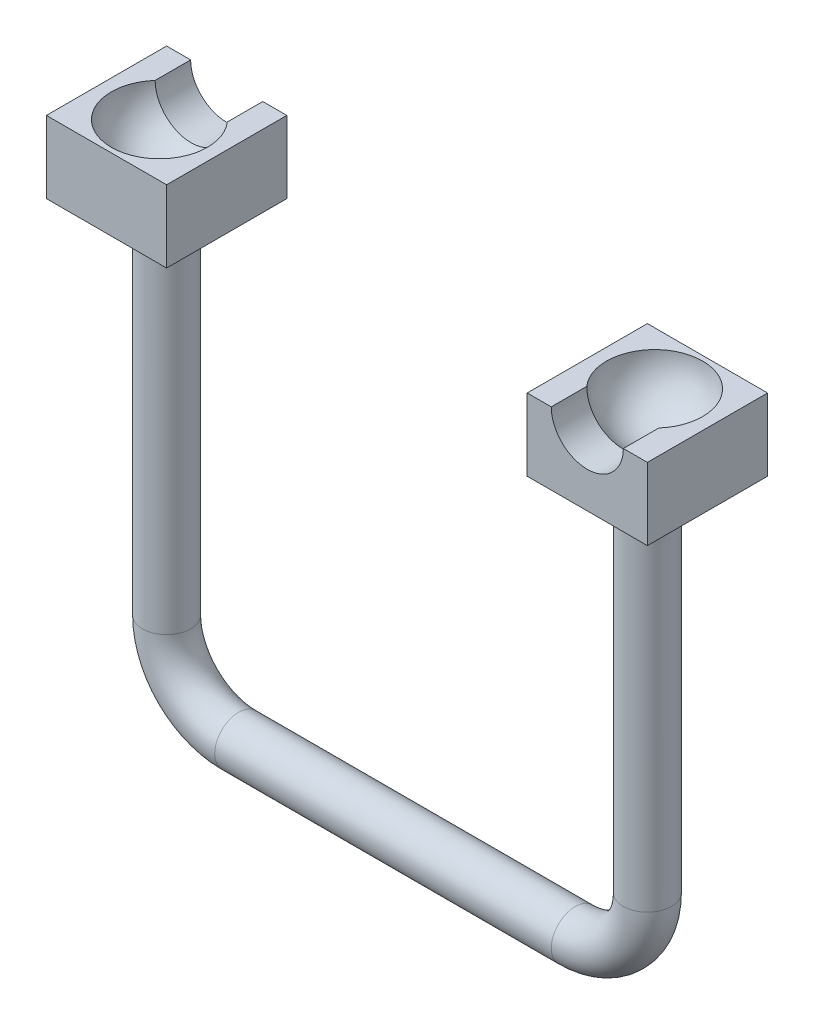
from build123d import *

# Parameters (mm, degrees)
SKETCH2_R           = 5
SKETCH4_W           = 25
SKETCH4_H           = 25
BOSS_EXTRUDE1_DEPTH = 15
SKETCH7_R           = 7.5
CUT_EXTRUDE2_DEPTH  = 15
SKETCH15_W          = 25
SKETCH15_H          = 25
BOSS_EXTRUDE3_DEPTH = 15
SKETCH17_R          = 7.5
CUT_EXTRUDE3_DEPTH  = 15


with BuildPart() as part:
    # Sweep1: sweep along a path in Sketch1
    with BuildLine(Plane.XY) as sweep1_path:
        Line((0, 0), (0, -75))
        ThreePointArc((0, -75), (4.393398122, -85.60660133), (14.999999452, -89.999999452))
        Line((14.999999452, -89.999999452), (85, -89.999999452))
        ThreePointArc((85, -89.999999452), (95.606601718, -85.60660117), (100, -74.999999452))
        Line((100, -74.999999452), (100, 0))
    # Sketch2 → Sweep1 (sweep)
    with BuildSketch(Plane(origin=(0, 0, 0), x_dir=(1, 0, 0), z_dir=(0, 1, 0))):
        Circle(SKETCH2_R)
    sweep(path=sweep1_path.line)

    # Sketch4 → Boss-Extrude1 (add)
    with BuildSketch(Plane(origin=(0, 0, 0), x_dir=(1, 0, 0), z_dir=(0, 1, 0))):
        Rectangle(SKETCH4_W, SKETCH4_H)
    extrude(amount=BOSS_EXTRUDE1_DEPTH)

    # Sketch5 → Cut-Revolve1 (revolve, cut)
    with BuildSketch(Plane(origin=(0, 15, 0), x_dir=(1, 0, 0), z_dir=(0, 1, 0))):
        with BuildLine():
            Line((0, 8.5), (0, -11.5))
            ThreePointArc((0, -11.5), (10, -1.5), (0, 8.5))
        make_face()
    revolve(axis=Axis((0, 15, -8.5), (0, 0, 1)), mode=Mode.SUBTRACT)

    # Sketch7 → Cut-Extrude2 (cut)
    with BuildSketch(Plane(origin=(0, 0, -12.5), x_dir=(-1, 0, 0), z_dir=(0, 0, -1))):
        with Locations((0, 15)):
            Circle(SKETCH7_R)
    extrude(amount=-CUT_EXTRUDE2_DEPTH, mode=Mode.SUBTRACT)

    # Sketch15 → Boss-Extrude3 (add)
    with BuildSketch(Plane(origin=(0, 0, 0), x_dir=(1, 0, 0), z_dir=(0, 1, 0))):
        with Locations((100, 0)):
            Rectangle(SKETCH15_W, SKETCH15_H)
    extrude(amount=BOSS_EXTRUDE3_DEPTH)

    # Sketch16 → Cut-Revolve2 (revolve, cut)
    with BuildSketch(Plane(origin=(0, 15, 0), x_dir=(1, 0, 0), z_dir=(0, 1, 0))):
        with BuildLine():
            Line((100, 11.5), (100, -8.5))
            ThreePointArc((100, -8.5), (110, 1.5), (100, 11.5))
        make_face()
    revolve(axis=Axis((100, 15, -11.5), (0, 0, 1)), mode=Mode.SUBTRACT)

    # Sketch17 → Cut-Extrude3 (cut)
    with BuildSketch(Plane.XY.offset(12.5)):
        with Locations((100, 15)):
            Circle(SKETCH17_R)
    extrude(amount=-CUT_EXTRUDE3_DEPTH, mode=Mode.SUBTRACT)


solid = part.part
